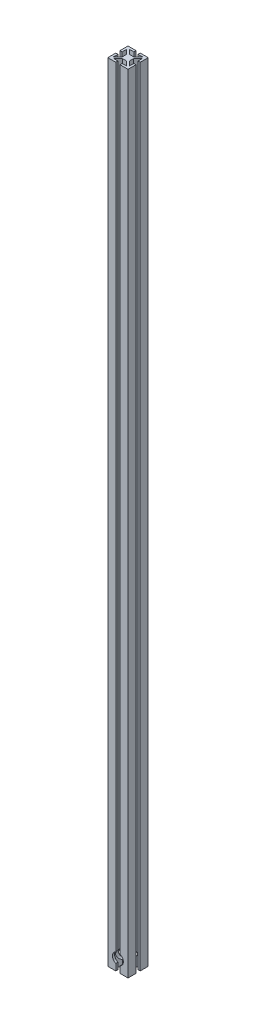
from build123d import *

# Parameters (mm, degrees)
BOSS_EXTRUDE1_DEPTH = 1485.9
SKETCH3_R           = 10.287
CUT_EXTRUDE1_DEPTH  = 16.51


with BuildPart() as part:
    # Sketch2 → Boss-Extrude1 (new body)
    with BuildSketch(Plane(origin=(0.594697292, 0, 0.594697292), x_dir=(1, 0, 0), z_dir=(0, 1, 0))):
        Polygon((-19.644697292, 19.644697292), (-4.658697292, 19.644697292), (-4.658697292, 15.580697292), (-12.707015333, 15.580697292), (-4.477415333, 7.351097292), (3.288020749, 7.351097292), (11.517620749, 15.580697292), (3.469302708, 15.580697292), (3.469302708, 19.644697292), (18.455302708, 19.644697292), (18.455302708, 4.658697292), (14.391302708, 4.658697292), (14.391302708, 12.707015333), (6.161702708, 4.477415333), (6.161702708, -3.288020749), (14.391302708, -11.517620749), (14.391302708, -3.469302708), (18.455302708, -3.469302708), (18.455302708, -18.455302708), (3.469302708, -18.455302708), (3.469302708, -14.391302708), (11.517620749, -14.391302708), (3.288020749, -6.161702708), (-4.477415333, -6.161702708), (-12.707015333, -14.391302708), (-4.658697292, -14.391302708), (-4.658697292, -18.455302708), (-19.644697292, -18.455302708), (-19.644697292, -3.469302708), (-15.580697292, -3.469302708), (-15.580697292, -11.517620749), (-7.351097292, -3.288020749), (-7.351097292, 4.477415333), (-15.580697292, 12.707015333), (-15.580697292, 4.658697292), (-19.644697292, 4.658697292), align=None)
    extrude(amount=BOSS_EXTRUDE1_DEPTH)

    # Sketch3 → Cut-Extrude1 (cut)
    with BuildSketch(Plane(origin=(0, 0, -19.05), x_dir=(-1, 0, 0), z_dir=(0, 0, -1))):
        with Locations(Location((0, 21.844, 0), (0, 0, 48.944473627))):
            Circle(SKETCH3_R)
    cut_extrude1 = extrude(amount=-CUT_EXTRUDE1_DEPTH, mode=Mode.SUBTRACT)

    # Mirror1: Cut-Extrude1 across plane
    add(cut_extrude1.mirror(Plane.XY), mode=Mode.SUBTRACT)


solid = part.part
